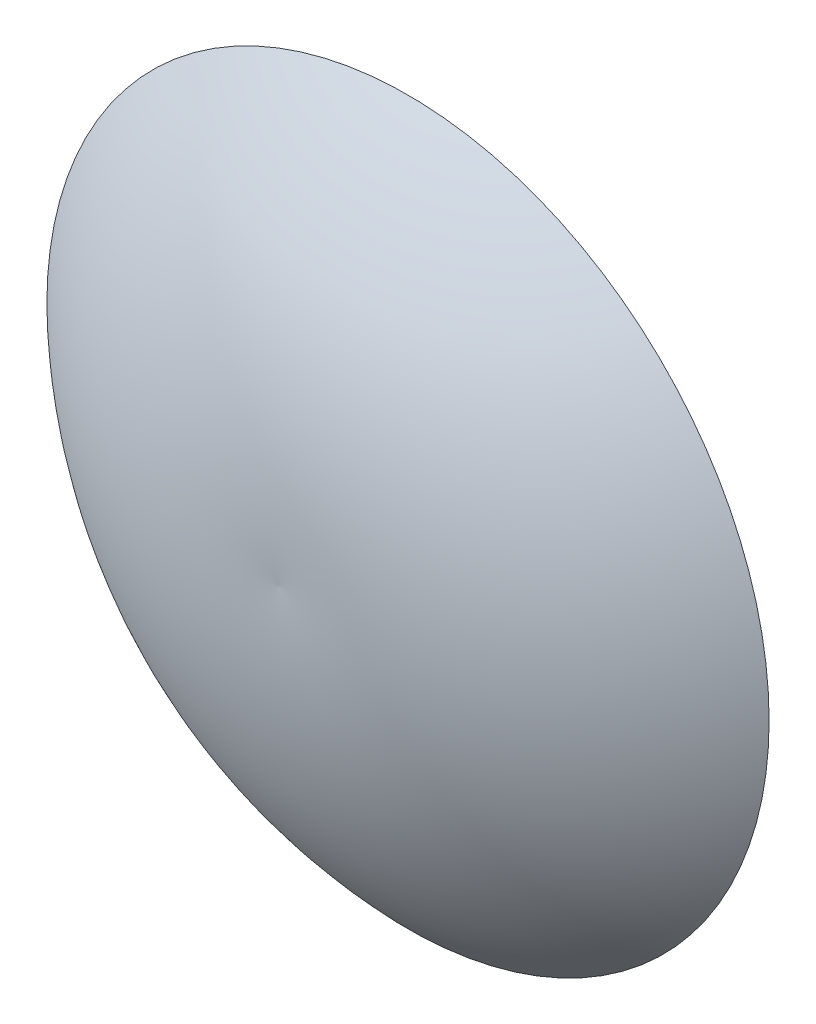
from build123d import *


with BuildPart() as part:
    # Sketch1 → Revolve1 (revolve)
    with BuildSketch(Plane(origin=(-1746.831054074, 24.845075825, -69.295107942), x_dir=(0, 0, -1), z_dir=(1, 0, 0))):
        with BuildLine():
            Line((-4692.501014175, -1194.519728201), (-3960.510776168, -1194.519728201))
            Line((-3960.510776168, -1194.519728201), (-3960.510776168, 857.159576831))
            ThreePointArc((-3960.510776168, 857.159576831), (-4541.254486388, -92.062900666), (-4692.501014175, -1194.519728201))
        make_face()
    revolve(axis=Axis((-1746.831054074, -1169.674652376, 4623.205906233), (0, 0, -1)))


solid = part.part
